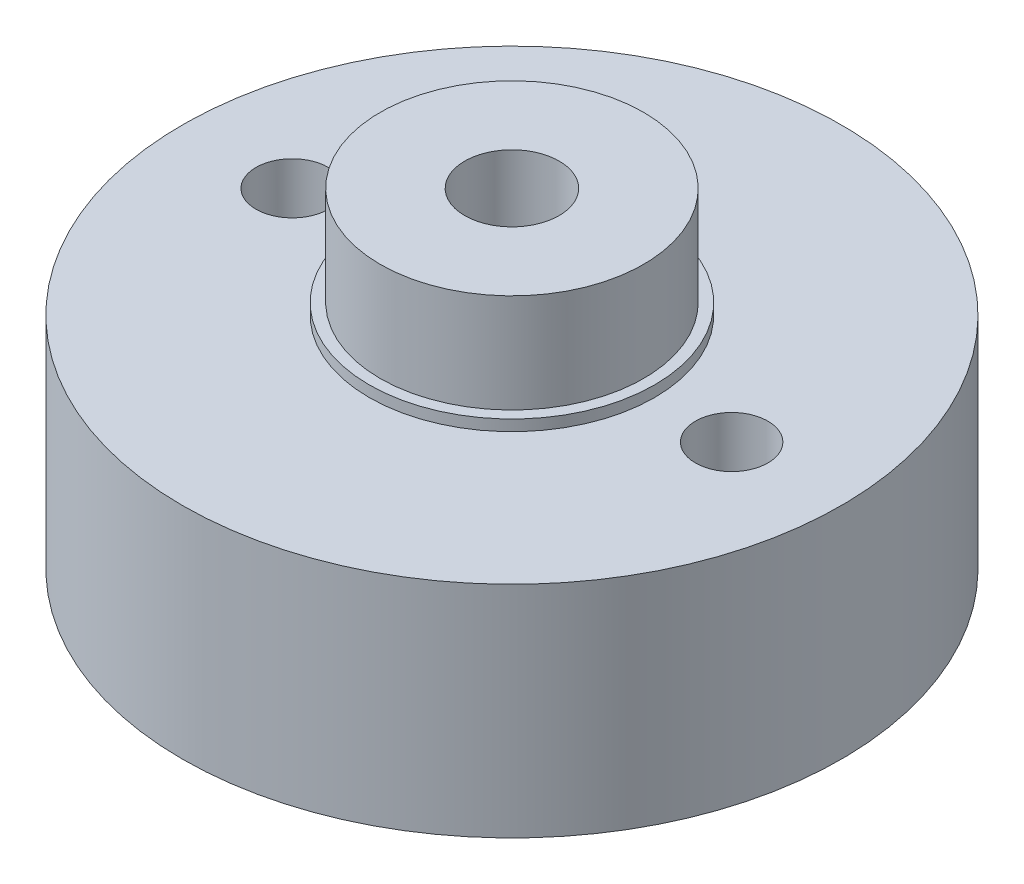
from build123d import *

# Parameters (mm, degrees)
SKETCH_1_R          = 15
EXTRUDE_1_DEPTH     = 10
SKETCH_2_R          = 5.995
EXTRUDE_2_DEPTH     = 5
SKETCH_3_R          = 6.495
EXTRUDE_3_DEPTH     = 0.5
SKETCH_4_R          = 1.65
CUT_EXTRUDE_1_DEPTH = 10
SKETCH_5_R          = 2.15
CUT_EXTRUDE_2_DEPTH = 15


with BuildPart() as part:
    # ｽｹｯﾁ1 → ﾎﾞｽ - 押し出し1 (new body)
    with BuildSketch(Plane(origin=(0, 0, 0), x_dir=(1, 0, 0), z_dir=(0, 1, 0))):
        with Locations(Location((0, 0, 0), (0, 0, 270))):
            Circle(SKETCH_1_R)
    extrude(amount=EXTRUDE_1_DEPTH)

    # ｽｹｯﾁ2 → ﾎﾞｽ - 押し出し2 (add)
    with BuildSketch(Plane(origin=(0, 10, 0), x_dir=(1, 0, 0), z_dir=(0, 1, 0))):
        with Locations(Location((0, 0, 0), (0, 0, 270))):
            Circle(SKETCH_2_R)
    extrude(amount=EXTRUDE_2_DEPTH)

    # ｽｹｯﾁ3 → ﾎﾞｽ - 押し出し3 (add)
    with BuildSketch(Plane(origin=(0, 10, 0), x_dir=(1, 0, 0), z_dir=(0, 1, 0))):
        with Locations(Location((0, 0, 0), (0, 0, 270))):
            Circle(SKETCH_3_R)
    extrude(amount=EXTRUDE_3_DEPTH)

    # ｽｹｯﾁ4 → ｶｯﾄ - 押し出し1 (cut)
    with BuildSketch(Plane(origin=(0, 10, 0), x_dir=(1, 0, 0), z_dir=(0, 1, 0))):
        with Locations(Location((10, 0, 0), (0, 0, 270))):
            Circle(SKETCH_4_R)
        with Locations(Location((-10, 0, 0), (0, 0, 270))):
            Circle(SKETCH_4_R)
    extrude(amount=-CUT_EXTRUDE_1_DEPTH, mode=Mode.SUBTRACT)

    # ｽｹｯﾁ5 → ｶｯﾄ - 押し出し2 (cut)
    with BuildSketch(Plane(origin=(0, 15, 0), x_dir=(1, 0, 0), z_dir=(0, 1, 0))):
        with Locations(Location((0, 0, 0), (0, 0, 270))):
            Circle(SKETCH_5_R)
    extrude(amount=-CUT_EXTRUDE_2_DEPTH, mode=Mode.SUBTRACT)


solid = part.part
